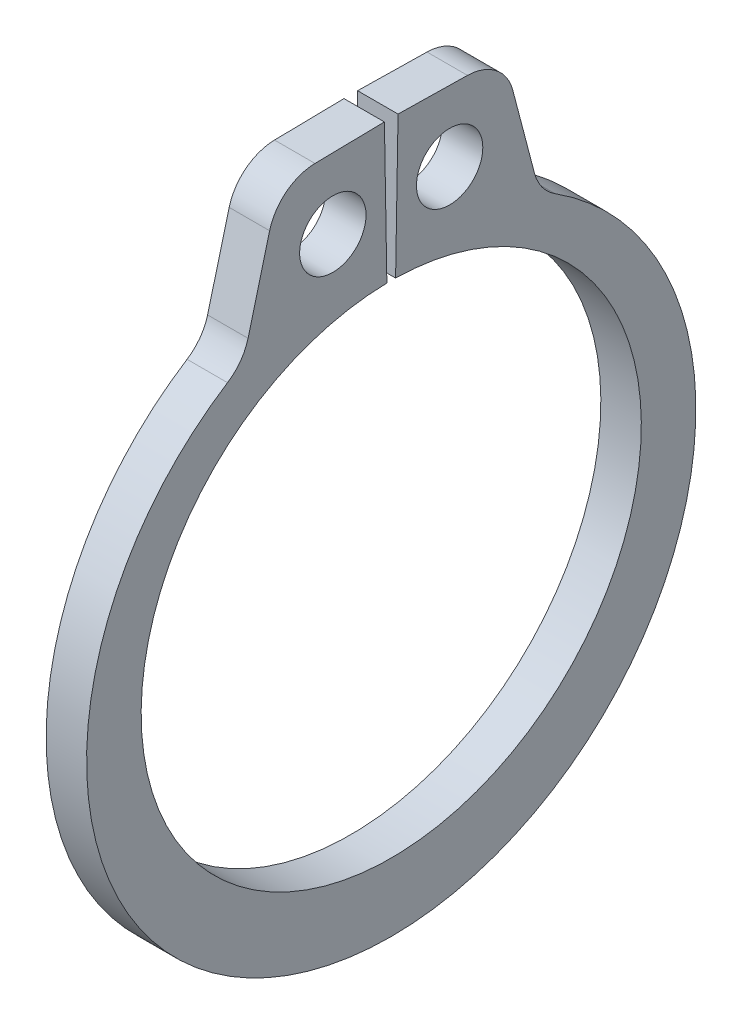
from build123d import *

# Parameters (mm, degrees)
SKETCH1_R      = 0.5207
EXTRUDE1_DEPTH = 0.3175
FILLET1_R      = 0.7493


with BuildPart() as part:
    # Sketch1 → Extrude1 (new, symmetric)
    with BuildSketch(Plane(origin=(0, 0, 0), x_dir=(0, 0, -1), z_dir=(1, 0, 0))):
        with BuildLine():
            Line((-0.068488479, 3.92370231), (-0.107054806, 6.133165747))
            Line((-0.107054806, 6.133165747), (-1.764152384, 6.104241001))
            Line((-1.764152384, 6.104241001), (-2.324254278, 3.96660167))
            ThreePointArc((-2.324254278, 3.96660167), (0, -4.9911), (2.324254278, 3.96660167))
            Line((2.324254278, 3.96660167), (1.764152384, 6.104241001))
            Line((1.764152384, 6.104241001), (0.107054806, 6.133165747))
            Line((0.107054806, 6.133165747), (0.068488479, 3.92370231))
            ThreePointArc((0.068488479, 3.92370231), (0, -3.9243), (-0.068488479, 3.92370231))
        make_face()
        with Locations((-0.916320431, 5.013971656)):
            Circle(SKETCH1_R, mode=Mode.SUBTRACT)
        with Locations((0.916320431, 5.013971656)):
            Circle(SKETCH1_R, mode=Mode.SUBTRACT)
    extrude(amount=EXTRUDE1_DEPTH, both=True)

    # Fillet1
    fillet1_edges = [part.edges().sort_by_distance(p)[0] for p in [
        (0, 6.104241001, -1.764152384),
        (0, 3.96660167, -2.324254278),
        (0, 3.96660167, 2.324254278),
        (0, 6.104241001, 1.764152384),
    ]]
    fillet(fillet1_edges, radius=FILLET1_R)


solid = part.part
